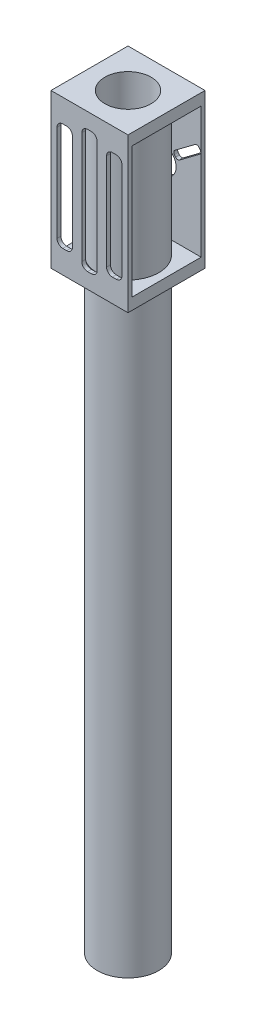
from build123d import *

# Parameters (mm, degrees)
SKETCH1_R           = 8
BOSS_EXTRUDE1_DEPTH = 154
SKETCH2_W           = 20
SKETCH2_H           = 20
BOSS_EXTRUDE2_DEPTH = 40
SKETCH3_W           = 18
SKETCH3_H           = 34
CUT_EXTRUDE1_DEPTH  = 196.28440798
SKETCH6_R           = 8
BOSS_EXTRUDE3_DEPTH = 34
SKETCH7_R           = 3.5
CUT_EXTRUDE4_DEPTH  = 1
CUT_EXTRUDE5_DEPTH  = 1
SKETCH4_R           = 6
CUT_EXTRUDE3_DEPTH  = 195.514780929


with BuildPart() as part:
    # Sketch1 → Boss-Extrude1 (new body)
    with BuildSketch(Plane(origin=(0, 0, 0), x_dir=(1, 0, 0), z_dir=(0, 1, 0))):
        with Locations(Location((0, 0, 0), (0, 0, 270))):
            Circle(SKETCH1_R)
    extrude(amount=BOSS_EXTRUDE1_DEPTH)

    # Sketch2 → Boss-Extrude2 (add)
    with BuildSketch(Plane(origin=(0, 154, 0), x_dir=(1, 0, 0), z_dir=(0, 1, 0))):
        Rectangle(SKETCH2_W, SKETCH2_H)
    extrude(amount=BOSS_EXTRUDE2_DEPTH)

    # Sketch3 → Cut-Extrude1 (cut, through all)
    with BuildSketch(Plane.ZY.offset(10)):
        with Locations((0, 174)):
            Rectangle(SKETCH3_W, SKETCH3_H)
    extrude(amount=-CUT_EXTRUDE1_DEPTH, mode=Mode.SUBTRACT)

    # Sketch6 → Boss-Extrude3 (add)
    with BuildSketch(Plane(origin=(0, 157, 0), x_dir=(1, 0, 0), z_dir=(0, 1, 0))):
        with Locations(Location((0, 0, 0), (0, 0, 270))):
            Circle(SKETCH6_R)
    extrude(amount=BOSS_EXTRUDE3_DEPTH)

    # Sketch7 → Cut-Extrude4 (cut)
    with BuildSketch(Plane(origin=(0, 0, -10), x_dir=(-1, 0, 0), z_dir=(0, 0, -1))):
        with Locations((0, 174)):
            Circle(SKETCH7_R)
        with BuildLine():
            Line((-0.25, 178), (0.25, 178))
            ThreePointArc((0.25, 178), (0.780330086, 178.219669914), (1, 178.75))
            Line((1, 178.75), (1, 185.25))
            ThreePointArc((1, 185.25), (0.780330086, 185.780330086), (0.25, 186))
            Line((0.25, 186), (-0.25, 186))
            ThreePointArc((-0.25, 186), (-0.780330086, 185.780330086), (-1, 185.25))
            Line((-1, 185.25), (-1, 178.75))
            ThreePointArc((-1, 178.75), (-0.780330086, 178.219669914), (-0.25, 178))
        make_face()
        with BuildLine():
            Line((-4.4, 176.05), (-9.6, 179.95))
            ThreePointArc((-9.6, 179.95), (-9.89246212, 180.443933983), (-9.75, 181))
            Line((-9.75, 181), (-9.45, 181.4))
            ThreePointArc((-9.45, 181.4), (-8.956066017, 181.69246212), (-8.4, 181.55))
            Line((-8.4, 181.55), (-3.2, 177.65))
            ThreePointArc((-3.2, 177.65), (-2.90753788, 177.156066017), (-3.05, 176.6))
            Line((-3.05, 176.6), (-3.35, 176.2))
            ThreePointArc((-3.35, 176.2), (-3.843933983, 175.90753788), (-4.4, 176.05))
        make_face()
        with BuildLine():
            Line((3.2, 177.65), (8.4, 181.55))
            ThreePointArc((8.4, 181.55), (8.956066017, 181.69246212), (9.45, 181.4))
            Line((9.45, 181.4), (9.75, 181))
            ThreePointArc((9.75, 181), (9.89246212, 180.443933983), (9.6, 179.95))
            Line((9.6, 179.95), (4.4, 176.05))
            ThreePointArc((4.4, 176.05), (3.843933983, 175.90753788), (3.35, 176.2))
            Line((3.35, 176.2), (3.05, 176.6))
            ThreePointArc((3.05, 176.6), (2.90753788, 177.156066017), (3.2, 177.65))
        make_face()
        with BuildLine():
            Line((3.35, 263.8), (3.05, 263.4))
            ThreePointArc((3.05, 263.4), (2.90753788, 262.843933983), (3.2, 262.35))
            Line((3.2, 262.35), (8.4, 258.45))
            ThreePointArc((8.4, 258.45), (8.956066017, 258.30753788), (9.45, 258.6))
            Line((9.45, 258.6), (9.75, 259))
            ThreePointArc((9.75, 259), (9.89246212, 259.556066017), (9.6, 260.05))
            Line((9.6, 260.05), (4.4, 263.95))
            ThreePointArc((4.4, 263.95), (3.843933983, 264.09246212), (3.35, 263.8))
        make_face()
        with BuildLine():
            Line((-3.05, 263.4), (-3.35, 263.8))
            ThreePointArc((-3.35, 263.8), (-3.843933983, 264.09246212), (-4.4, 263.95))
            Line((-4.4, 263.95), (-9.6, 260.05))
            ThreePointArc((-9.6, 260.05), (-9.89246212, 259.556066017), (-9.75, 259))
            Line((-9.75, 259), (-9.45, 258.6))
            ThreePointArc((-9.45, 258.6), (-8.956066017, 258.30753788), (-8.4, 258.45))
            Line((-8.4, 258.45), (-3.2, 262.35))
            ThreePointArc((-3.2, 262.35), (-2.90753788, 262.843933983), (-3.05, 263.4))
        make_face()
        with BuildLine():
            Line((1, 261.25), (1, 254.75))
            ThreePointArc((1, 254.75), (0.780330086, 254.219669914), (0.25, 254))
            Line((0.25, 254), (-0.25, 254))
            ThreePointArc((-0.25, 254), (-0.780330086, 254.219669914), (-1, 254.75))
            Line((-1, 254.75), (-1, 261.25))
            ThreePointArc((-1, 261.25), (-0.780330086, 261.780330086), (-0.25, 262))
            Line((-0.25, 262), (0.25, 262))
            ThreePointArc((0.25, 262), (0.780330086, 261.780330086), (1, 261.25))
        make_face()
    extrude(amount=-CUT_EXTRUDE4_DEPTH, mode=Mode.SUBTRACT)

    # Sketch8 → Cut-Extrude5 (cut)
    with BuildSketch(Plane.XY.offset(10)):
        with BuildLine():
            Line((-0.5, 158), (0.5, 158))
            ThreePointArc((0.5, 158), (1.560660172, 158.439339828), (2, 159.5))
            Line((2, 159.5), (2, 188.5))
            ThreePointArc((2, 188.5), (1.560660172, 189.560660172), (0.5, 190))
            Line((0.5, 190), (-0.5, 190))
            ThreePointArc((-0.5, 190), (-1.560660172, 189.560660172), (-2, 188.5))
            Line((-2, 188.5), (-2, 159.5))
            ThreePointArc((-2, 159.5), (-1.560660172, 158.439339828), (-0.5, 158))
        make_face()
        with BuildLine():
            Line((-6.932239868, 160), (-5.932239868, 160))
            ThreePointArc((-5.932239868, 160), (-4.871579696, 160.439339828), (-4.432239868, 161.5))
            Line((-4.432239868, 161.5), (-4.432239868, 186.5))
            ThreePointArc((-4.432239868, 186.5), (-4.871579696, 187.560660172), (-5.932239868, 188))
            Line((-5.932239868, 188), (-6.932239868, 188))
            ThreePointArc((-6.932239868, 188), (-7.992900039, 187.560660172), (-8.432239868, 186.5))
            Line((-8.432239868, 186.5), (-8.432239868, 161.5))
            ThreePointArc((-8.432239868, 161.5), (-7.992900039, 160.439339828), (-6.932239868, 160))
        make_face()
        with BuildLine():
            Line((4.432239868, 161.5), (4.432239868, 186.5))
            ThreePointArc((4.432239868, 186.5), (4.871579696, 187.560660172), (5.932239868, 188))
            Line((5.932239868, 188), (6.932239868, 188))
            ThreePointArc((6.932239868, 188), (7.992900039, 187.560660172), (8.432239868, 186.5))
            Line((8.432239868, 186.5), (8.432239868, 161.5))
            ThreePointArc((8.432239868, 161.5), (7.992900039, 160.439339828), (6.932239868, 160))
            Line((6.932239868, 160), (5.932239868, 160))
            ThreePointArc((5.932239868, 160), (4.871579696, 160.439339828), (4.432239868, 161.5))
        make_face()
    extrude(amount=-CUT_EXTRUDE5_DEPTH, mode=Mode.SUBTRACT)

    # Sketch4 → Cut-Extrude3 (cut, through all)
    with BuildSketch(Plane(origin=(0, 194, 0), x_dir=(1, 0, 0), z_dir=(0, 1, 0))):
        with Locations(Location((0, 0, 0), (0, 0, 270))):
            Circle(SKETCH4_R)
    extrude(amount=-CUT_EXTRUDE3_DEPTH, mode=Mode.SUBTRACT)


solid = part.part
